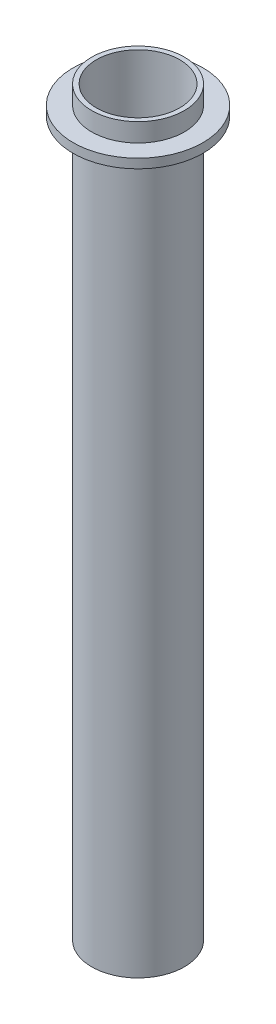
from build123d import *


with BuildPart() as part:
    # Sketch2 → Revolve1 (revolve)
    with BuildSketch(Plane.XY, mode=Mode.PRIVATE) as revolve1_sk:
        Polygon((-7.14375, 0), (-7.14375, 127), (-7.9375, 127), (-7.9375, 123.825), (-11.1125, 123.825), (-11.1125, 122.2375), (-7.9375, 122.2375), (-7.9375, 0), align=None)
    revolve(revolve1_sk.sketch.rotate(Axis((0, 0, 0), (0, 1, 0)), 270), axis=Axis((0, 0, 0), (0, 1, 0)))


solid = part.part
